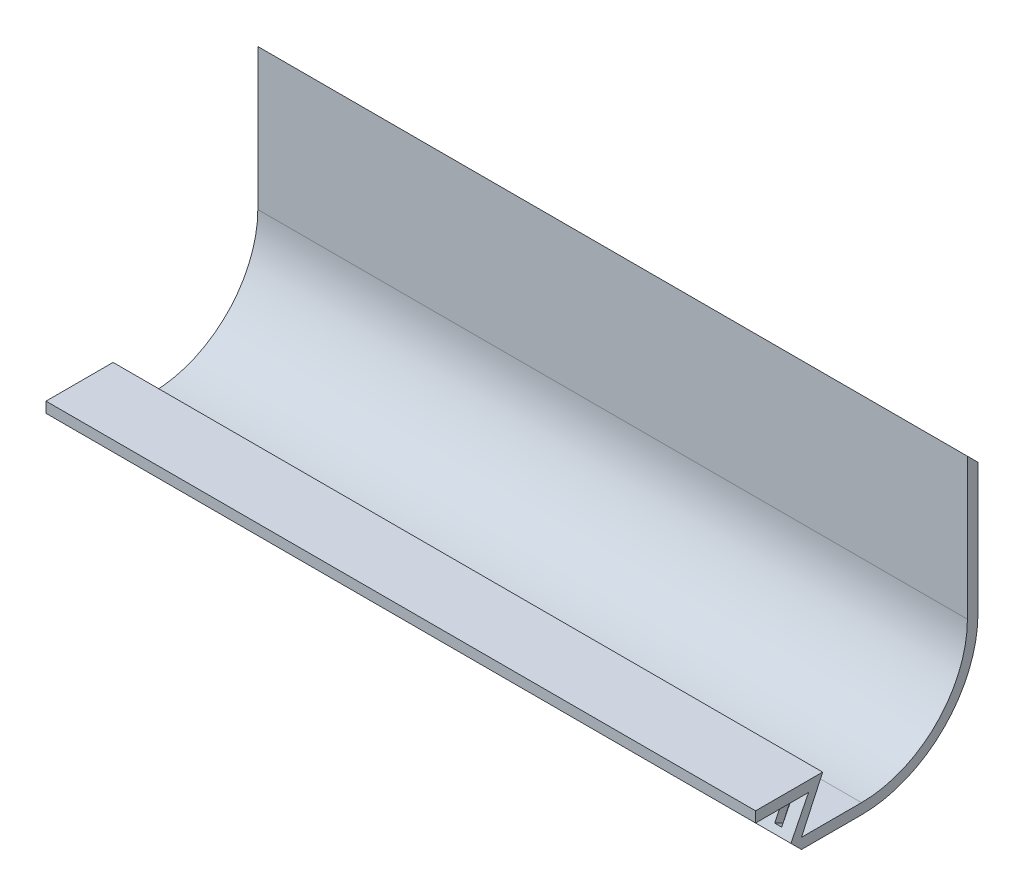
from build123d import *

# Parameters (mm, degrees)
EXTRUDE_1_DEPTH          = 3
EXTRUDE_2_DEPTH          = 287
CUT_EXTRUDE_6_DEPTH      = 100
CUT_EXTRUDE_6_DEPTH_BACK = 100
SKETCH_6_W               = 73.604658964
SKETCH_6_H               = 229.904852756
SKETCH_6_W_2             = 157.433287981
SKETCH_6_H_2             = 225.799979151
SKETCH_7_W               = 3
SKETCH_7_H               = 140
CUT_EXTRUDE_7_DEPTH      = 272.560306378
CUT_EXTRUDE_START        = -2.662708
SKETCH_8_W               = 2
SKETCH_8_H               = 10
CUT_EXTRUDE_8_DEPTH      = 2.662708


with BuildPart() as part:
    # 草图1 → 凸台-拉伸1 (new body)
    with BuildSketch(Plane.XY):
        Polygon((-143.75, 30), (-143.75, 70), (-105.75, 70), (-105.75, 65), (-100.25, 65), (-100.25, 70), (99.75, 70), (99.75, 65), (105.25, 65), (105.25, 70), (143.25, 70), (143.25, 30), (135.25, 30), (135.25, -30), (143.25, -30), (143.25, -70), (105.25, -70), (105.25, -65), (99.75, -65), (99.75, -70), (-100.25, -70), (-100.25, -65), (-105.75, -65), (-105.75, -70), (-143.75, -70), (-143.75, -30), (-135.75, -30), (-135.75, 30), align=None)
    extrude(amount=EXTRUDE_1_DEPTH)

    # 草图2 → 凸台-拉伸2 (add)
    with BuildSketch(Plane.ZY.offset(143.75)):
        with BuildLine():
            Line((0, 70), (0, 30))
            Line((0, 30), (-3, 33))
            Line((-3, 33), (-3, 70))
            ThreePointArc((-3, 70), (6.665476221, 93.334523779), (30, 103))
            Line((30, 103), (47, 103))
            Line((47, 103), (50, 100))
            Line((50, 100), (45, 90))
            Line((45, 90), (60, 90))
            Line((60, 90), (60, 87))
            Line((60, 87), (41, 87))
            Line((41, 87), (47, 100))
            Line((47, 100), (30, 100))
            ThreePointArc((30, 100), (8.786796564, 91.213203436), (0, 70))
        make_face()
        with BuildLine():
            Line((30, -100), (47, -100))
            Line((47, -100), (41, -87))
            Line((41, -87), (60, -87))
            Line((60, -87), (60, -90))
            Line((60, -90), (45, -90))
            Line((45, -90), (50, -100))
            Line((50, -100), (47, -103))
            Line((47, -103), (30, -103))
            ThreePointArc((30, -103), (6.665476221, -93.334523779), (-3, -70))
            Line((-3, -70), (-3, -33))
            Line((-3, -33), (0, -30))
            Line((0, -30), (0, -70))
            ThreePointArc((0, -70), (8.786796564, -91.213203436), (30, -100))
        make_face()
    extrude(amount=-EXTRUDE_2_DEPTH)

    # 草图6 → 切除-拉伸6 (cut, two sides: drawn at the far end of the back side and taken through both)
    with BuildSketch(Plane.XY.offset(-CUT_EXTRUDE_6_DEPTH_BACK)):
        with Locations((137.052329482, -11.952426378)):
            Rectangle(SKETCH_6_W, SKETCH_6_H)
        with Locations((-179.466643991, -9.899989576)):
            Rectangle(SKETCH_6_W_2, SKETCH_6_H_2)
    extrude(amount=CUT_EXTRUDE_6_DEPTH + CUT_EXTRUDE_6_DEPTH_BACK, mode=Mode.SUBTRACT)

    # 草图7 → 切除-拉伸7 (cut, through all)
    with BuildSketch(Plane(origin=(143.25, 0, 0), x_dir=(0, 0, -1), z_dir=(1, 0, 0))):
        with Locations((-1.5, 0)):
            Rectangle(SKETCH_7_W, SKETCH_7_H)
    extrude(amount=-CUT_EXTRUDE_7_DEPTH, mode=Mode.SUBTRACT)


with BuildPart() as body_2:
    # of the pieces the cut leaves, the one that is kept (cut_extrude_7_keep)
    add(part.part.solids().sort_by_distance((-100.75, -70, 0))[0])

    # 草图8 → 切除-拉伸8 (cut)
    with BuildSketch(Plane(origin=(0, 0, 0), x_dir=(1, 0, 0), z_dir=(0, 0.4472135954999584, 0.8944271909999156)).offset(CUT_EXTRUDE_START)):
        with Locations((-96.25, -104.803398875)):
            Rectangle(SKETCH_8_W, SKETCH_8_H)
        with Locations((-90.25, -104.803398875)):
            Rectangle(SKETCH_8_W, SKETCH_8_H)
        with Locations((-84.25, -104.803398875)):
            Rectangle(SKETCH_8_W, SKETCH_8_H)
        with Locations((-78.25, -104.803398875)):
            Rectangle(SKETCH_8_W, SKETCH_8_H)
        with Locations((-72.25, -104.803398875)):
            Rectangle(SKETCH_8_W, SKETCH_8_H)
        with Locations((-66.25, -104.803398875)):
            Rectangle(SKETCH_8_W, SKETCH_8_H)
        with Locations((-60.25, -104.803398875)):
            Rectangle(SKETCH_8_W, SKETCH_8_H)
        with Locations((-54.25, -104.803398875)):
            Rectangle(SKETCH_8_W, SKETCH_8_H)
        with Locations((-48.25, -104.803398875)):
            Rectangle(SKETCH_8_W, SKETCH_8_H)
        with Locations((-42.25, -104.803398875)):
            Rectangle(SKETCH_8_W, SKETCH_8_H)
        with Locations((-36.25, -104.803398875)):
            Rectangle(SKETCH_8_W, SKETCH_8_H)
        with Locations((-30.25, -104.803398875)):
            Rectangle(SKETCH_8_W, SKETCH_8_H)
        with Locations((-24.25, -104.803398875)):
            Rectangle(SKETCH_8_W, SKETCH_8_H)
        with Locations((-18.25, -104.803398875)):
            Rectangle(SKETCH_8_W, SKETCH_8_H)
        with Locations((-12.25, -104.803398875)):
            Rectangle(SKETCH_8_W, SKETCH_8_H)
        with Locations((-6.25, -104.803398875)):
            Rectangle(SKETCH_8_W, SKETCH_8_H)
        with Locations((-0.25, -104.803398875)):
            Rectangle(SKETCH_8_W, SKETCH_8_H)
        with Locations((5.75, -104.803398875)):
            Rectangle(SKETCH_8_W, SKETCH_8_H)
        with Locations((11.75, -104.803398875)):
            Rectangle(SKETCH_8_W, SKETCH_8_H)
        with Locations((17.75, -104.803398875)):
            Rectangle(SKETCH_8_W, SKETCH_8_H)
        with Locations((23.75, -104.803398875)):
            Rectangle(SKETCH_8_W, SKETCH_8_H)
        with Locations((29.75, -104.803398875)):
            Rectangle(SKETCH_8_W, SKETCH_8_H)
        with Locations((35.75, -104.803398875)):
            Rectangle(SKETCH_8_W, SKETCH_8_H)
        with Locations((41.75, -104.803398875)):
            Rectangle(SKETCH_8_W, SKETCH_8_H)
        with Locations((47.75, -104.803398875)):
            Rectangle(SKETCH_8_W, SKETCH_8_H)
        with Locations((53.75, -104.803398875)):
            Rectangle(SKETCH_8_W, SKETCH_8_H)
        with Locations((59.75, -104.803398875)):
            Rectangle(SKETCH_8_W, SKETCH_8_H)
        with Locations((65.75, -104.803398875)):
            Rectangle(SKETCH_8_W, SKETCH_8_H)
        with Locations((71.75, -104.803398875)):
            Rectangle(SKETCH_8_W, SKETCH_8_H)
        with Locations((77.75, -104.803398875)):
            Rectangle(SKETCH_8_W, SKETCH_8_H)
        with Locations((83.75, -104.803398875)):
            Rectangle(SKETCH_8_W, SKETCH_8_H)
        with Locations((89.75, -104.803398875)):
            Rectangle(SKETCH_8_W, SKETCH_8_H)
        with Locations((95.75, -104.803398875)):
            Rectangle(SKETCH_8_W, SKETCH_8_H)
    extrude(amount=CUT_EXTRUDE_8_DEPTH, mode=Mode.SUBTRACT)


solid = body_2.part
